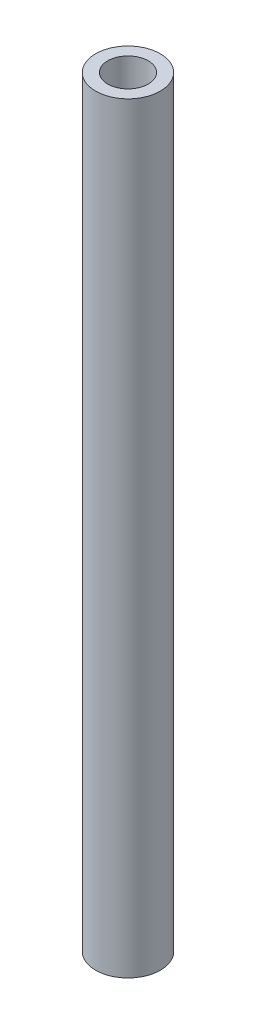
from build123d import *

# Parameters (mm, degrees)
SZKIC1_R                    = 4
SZKIC1_R_2                  = 2.5
DODANIE_WYCI_GNI_CIE1_DEPTH = 94.1


with BuildPart() as part:
    # Szkic1 → Dodanie-wyciągnięcie1 (new body)
    with BuildSketch(Plane(origin=(0, 0, 0), x_dir=(1, 0, 0), z_dir=(0, 1, 0))):
        with Locations(Location((0, 0, 0), (0, 0, 270))):
            Circle(SZKIC1_R)
        with Locations(Location((0, 0, 0), (0, 0, 270))):
            Circle(SZKIC1_R_2, mode=Mode.SUBTRACT)
    extrude(amount=DODANIE_WYCI_GNI_CIE1_DEPTH)


solid = part.part
